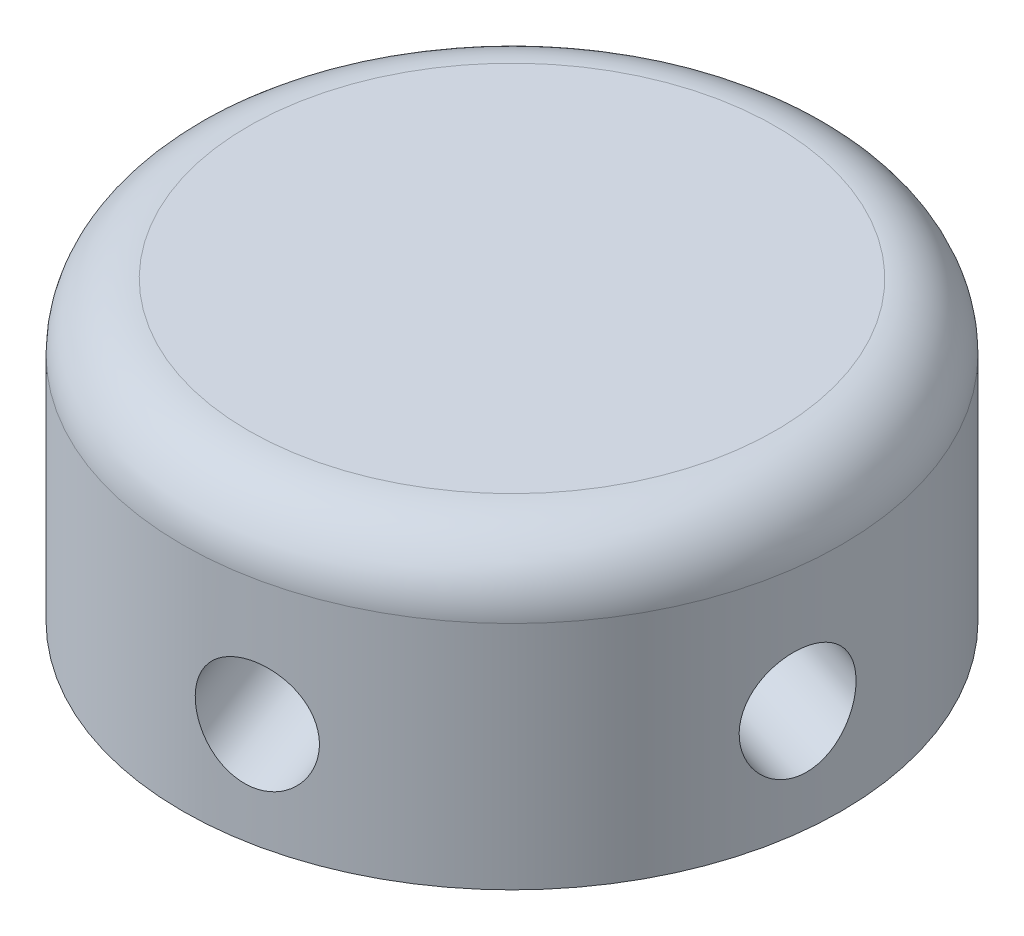
from build123d import *

# Parameters (mm, degrees)
BOSS_EXTRUDE1_DEPTH      = 3
BOSS_EXTRUDE1_DEPTH_BACK = 6
SKETCH1_R                = 10
SKETCH4_R                = 1.6
HOLE_DEPTH               = 19.539009706
HOLECIR_COUNT            = 5
FILLET3_R                = 2


with BuildPart() as part:
    # Sketch1 → Boss-Extrude1 (new, two sides: drawn at the far end of the back side and taken through both)
    with BuildSketch(Plane(origin=(0, 0, 0), x_dir=(1, 0, 0), z_dir=(0, 1, 0)).offset(-BOSS_EXTRUDE1_DEPTH_BACK)):
        Circle(SKETCH1_R)
    extrude(amount=BOSS_EXTRUDE1_DEPTH + BOSS_EXTRUDE1_DEPTH_BACK)

    # Sketch4 → hole (cut, through all)
    with BuildSketch(Plane(origin=(-3.352872105, -1.093066116, 1.887711608), x_dir=(-0.4486862613641547, -0.14627571033740308, -0.8816371449912632), z_dir=(0.8382180262940947, 0.2732665289126682, -0.47192790187872385))):
        Circle(SKETCH4_R)
    hole = extrude(amount=-HOLE_DEPTH, mode=Mode.SUBTRACT)

    # holecir: hole ×5 about axis
    holecir_axis = Axis((0, 5.5, 0), (0, -1, 0))
    for i in range(1, HOLECIR_COUNT):
        add(hole.rotate(holecir_axis, i * 360 / HOLECIR_COUNT), mode=Mode.SUBTRACT)

    # Fillet3
    fillet3_edges = [part.edges().sort_by_distance(p)[0] for p in [
        (-10, 3, 0),
    ]]
    fillet(fillet3_edges, radius=FILLET3_R)


solid = part.part
